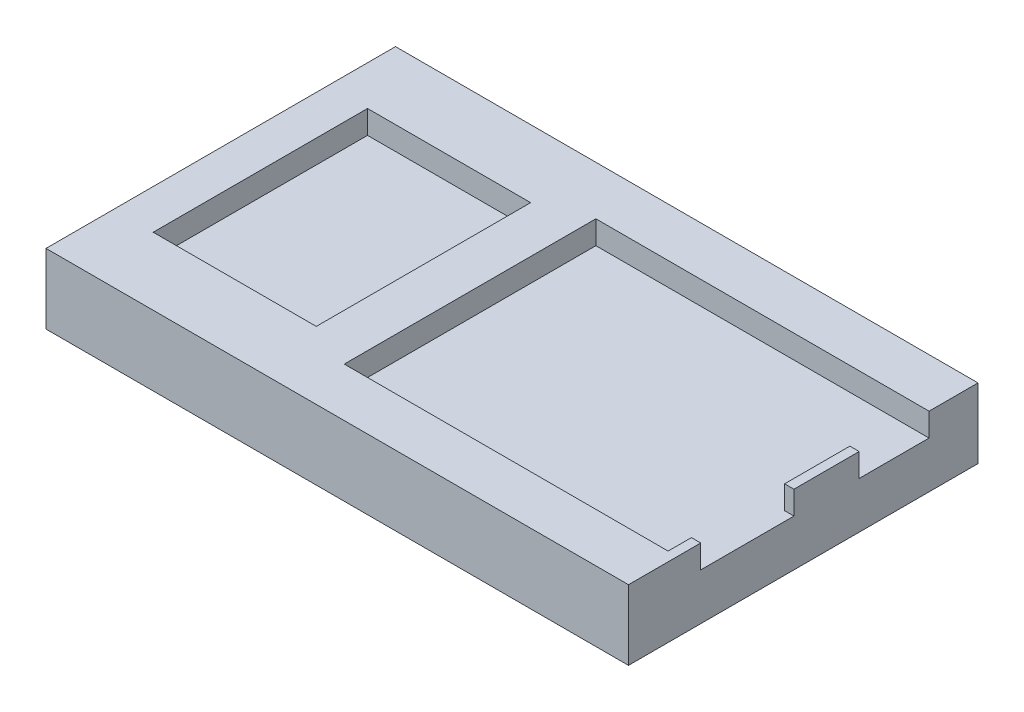
from build123d import *

# Parameters (mm, degrees)
SKETCH1_W           = 125
SKETCH1_H           = 75
BOSS_EXTRUDE1_DEPTH = 15
SKETCH2_W           = 35
SKETCH2_H           = 46
CUT_EXTRUDE4_DEPTH  = 5
SKETCH3_W           = 5.6
SKETCH3_H           = 30
CUT_EXTRUDE5_DEPTH  = 5


with BuildPart() as part:
    # Sketch1 → Boss-Extrude1 (new body)
    with BuildSketch(Plane(origin=(0, 0, 0), x_dir=(1, 0, 0), z_dir=(0, 1, 0))):
        with Locations((62.5, 37.5)):
            Rectangle(SKETCH1_W, SKETCH1_H)
    extrude(amount=BOSS_EXTRUDE1_DEPTH)

    # Sketch2 → Cut-Extrude4 (cut)
    with BuildSketch(Plane(origin=(0, 15, 0), x_dir=(1, 0, 0), z_dir=(0, 1, 0))):
        Polygon((53.5, 64.5), (125, 64.5), (125, 49.5), (123, 49.5), (123, 35.5), (125, 35.5), (125, 15.5), (123, 15.5), (123, 10.5), (53.5, 10.5), align=None)
        with Locations((26, 37.5)):
            Rectangle(SKETCH2_W, SKETCH2_H)
    extrude(amount=-CUT_EXTRUDE4_DEPTH, mode=Mode.SUBTRACT)

    # Sketch3 → Cut-Extrude5 (cut)
    with BuildSketch(Plane.XZ):
        with Locations((17.8, -37.5)):
            Rectangle(SKETCH3_W, SKETCH3_H)
        with Locations((107.2, -37.5)):
            Rectangle(SKETCH3_W, SKETCH3_H)
    extrude(amount=-CUT_EXTRUDE5_DEPTH, mode=Mode.SUBTRACT)


solid = part.part
